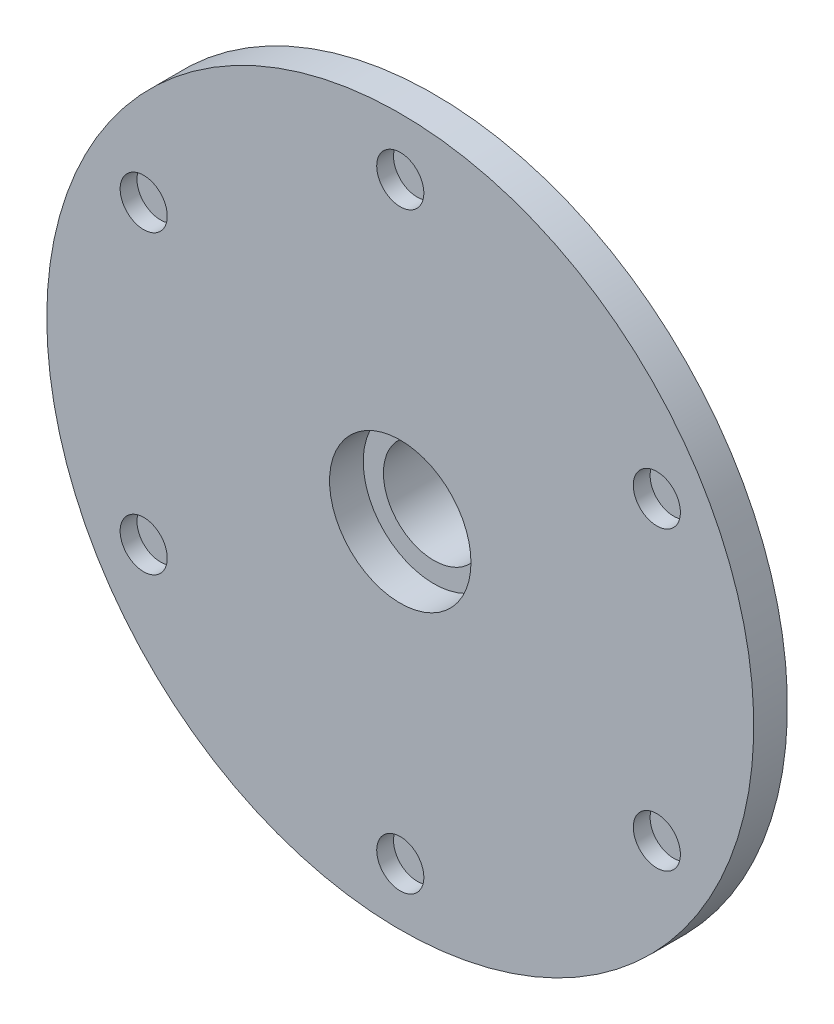
from build123d import *

# Parameters (mm, degrees)
SKETCH1_R           = 52.5
BOSS_EXTRUDE1_DEPTH = 13
SKETCH2_R           = 17.5
BOSS_EXTRUDE2_DEPTH = 7
SKETCH3_R           = 52.5
SKETCH3_R_2         = 25
CUT_EXTRUDE1_DEPTH  = 8
SKETCH4_R           = 7.5
CUT_EXTRUDE2_DEPTH  = 77.892782496
SKETCH5_R           = 10.5
CUT_EXTRUDE3_DEPTH  = 5
SKETCH6_R           = 3.5
CUT_EXTRUDE4_DEPTH  = 2.5


with BuildPart() as part:
    # Sketch1 → Boss-Extrude1 (new body)
    with BuildSketch(Plane.XY):
        with Locations(Location((0, 0, 0), (0, 0, 180))):
            Circle(SKETCH1_R)
    extrude(amount=BOSS_EXTRUDE1_DEPTH)

    # Sketch2 → Boss-Extrude2 (add)
    with BuildSketch(Plane(origin=(0, 0, 0), x_dir=(-1, 0, 0), z_dir=(0, 0, -1))):
        Circle(SKETCH2_R)
    extrude(amount=BOSS_EXTRUDE2_DEPTH)

    # Sketch3 → Cut-Extrude1 (cut)
    with BuildSketch(Plane(origin=(0, 0, 0), x_dir=(-1, 0, 0), z_dir=(0, 0, -1))):
        Circle(SKETCH3_R)
        Circle(SKETCH3_R_2, mode=Mode.SUBTRACT)
    extrude(amount=-CUT_EXTRUDE1_DEPTH, mode=Mode.SUBTRACT)

    # Sketch4 → Cut-Extrude2 (cut, through all)
    with BuildSketch(Plane(origin=(0, 0, -7), x_dir=(-1, 0, 0), z_dir=(0, 0, -1))):
        Circle(SKETCH4_R)
    extrude(amount=-CUT_EXTRUDE2_DEPTH, mode=Mode.SUBTRACT)

    # Sketch5 → Cut-Extrude3 (cut)
    with BuildSketch(Plane.XY.offset(13)):
        Circle(SKETCH5_R)
    extrude(amount=-CUT_EXTRUDE3_DEPTH, mode=Mode.SUBTRACT)

    # Sketch6 → Cut-Extrude4 (cut)
    with BuildSketch(Plane(origin=(0, 0, 13), x_dir=(-1, 0, 0), z_dir=(0, 0, -1))):
        with Locations((0, 44)):
            Circle(SKETCH6_R)
        with Locations((38.105117767, 22)):
            Circle(SKETCH6_R)
        with Locations((38.105117767, -22)):
            Circle(SKETCH6_R)
        with Locations((0, -44)):
            Circle(SKETCH6_R)
        with Locations((-38.105117767, -22)):
            Circle(SKETCH6_R)
        with Locations((-38.105117767, 22)):
            Circle(SKETCH6_R)
    extrude(amount=CUT_EXTRUDE4_DEPTH, mode=Mode.SUBTRACT)


solid = part.part
